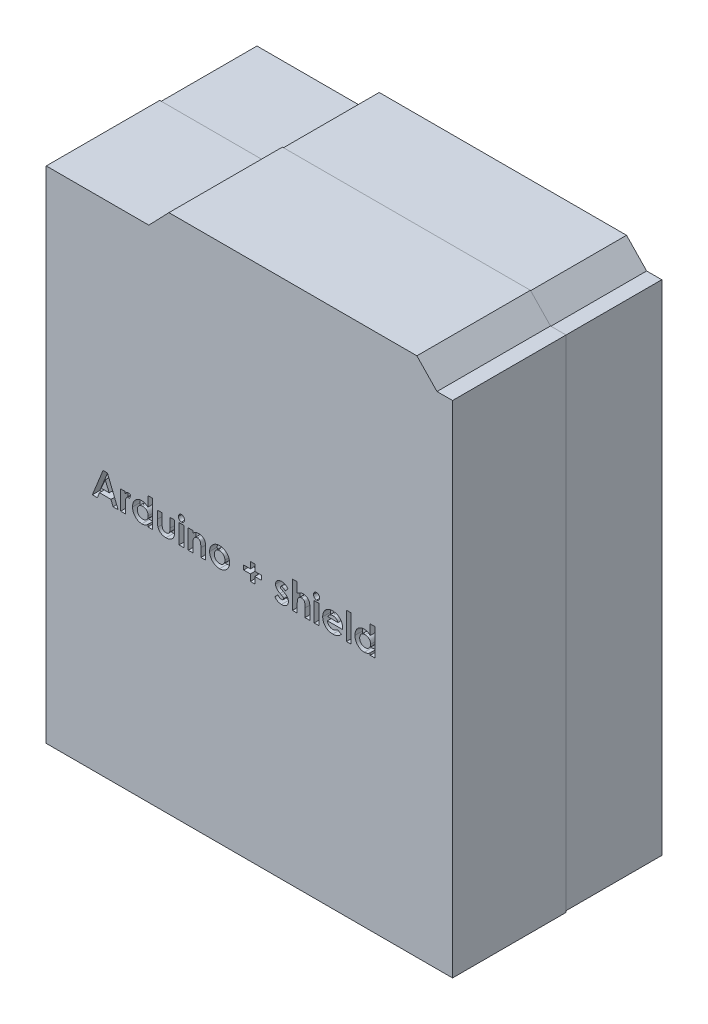
from build123d import *

# Parameters (mm, degrees)
SKETCH1_R           = 1.5
CARTE_DEPTH         = 12.75
PINS_DEPTH          = 2
BOSS_EXTRUDE3_DEPTH = 15
SKETCH4_W           = 0.628205128
SKETCH4_H           = 2.557692308
SKETCH4_W_2         = 0.628205129
SKETCH4_H_2         = 3.58974359
CUT_EXTRUDE1_DEPTH  = 1


with BuildPart() as part:
    # Sketch1 → carte (new body)
    with BuildSketch(Plane.XY):
        Polygon((-26.75, 32.95), (-13.25, 32.95), (-10.595, 35.71), (22.095, 35.71), (24.75, 32.95), (26.75, 32.95), (26.75, -32.95), (-26.75, -32.95), align=None)
        with Locations((19.45, 32.95)):
            Circle(SKETCH1_R, mode=Mode.SUBTRACT)
        with Locations((-8.75, 32.95)):
            Circle(SKETCH1_R, mode=Mode.SUBTRACT)
        with Locations((-24.05, -23.564882212)):
            Circle(SKETCH1_R, mode=Mode.SUBTRACT)
        with Locations((24.05, -23.564882212)):
            Circle(SKETCH1_R, mode=Mode.SUBTRACT)
    extrude(amount=CARTE_DEPTH)

    # Sketch2 → pins (add)
    with BuildSketch(Plane(origin=(0, 0, 0), x_dir=(-1, 0, 0), z_dir=(0, 0, -1))):
        Polygon((-21.75, 28.85639738), (-21.75, -27.95), (21.75, -27.95), (21.75, 27.95), (11.121914871, 27.95), (8.466914871, 30.71), (-19.966914871, 30.71), align=None)
        Polygon((-20.75, 28.453496065), (-20.75, -26.95), (20.75, -26.95), (20.75, 26.95), (10.696297845, 26.95), (8.041297845, 29.71), (-19.541297845, 29.71), align=None, mode=Mode.SUBTRACT)
    extrude(amount=PINS_DEPTH)

    # Sketch3 → Boss-Extrude3 (add)
    with BuildSketch(Plane.XY.offset(12.75)):
        Polygon((26.85, 33.05), (24.792561703, 33.05), (22.137561703, 35.81), (-10.637561703, 35.81), (-13.292561703, 33.05), (-26.85, 33.05), (-26.85, -33.05), (26.85, -33.05), align=None)
    extrude(amount=BOSS_EXTRUDE3_DEPTH)

    # Sketch4 → Cut-Extrude1 (cut)
    # profile 1 of 16: a face of its own
    with BuildSketch(Plane.XY.offset(27.75)):
        Polygon((-19.34439366, 1.94747819), (-18.761761448, 1.94747819), (-17.34829991, -1.55252181), (-18.019273468, -1.55252181), (-18.291308724, -0.834573092), (-19.816248628, -0.834573092), (-20.088283884, -1.55252181), (-20.75855632, -1.55252181), align=None)
        Polygon((-19.053428115, 1.008676107), (-19.577867218, -0.206367964), (-18.528989012, -0.206367964), align=None, mode=Mode.SUBTRACT)
    # profile 2 of 16: a face of its own
    with BuildSketch(Plane.XY.offset(27.75)):
        with BuildLine():
            Line((-17.011761448, 1.005170498), (-16.47329991, 1.005170498))
            Line((-16.47329991, 1.005170498), (-16.47329991, 0.690366812))
            add(Edge.make_bspline(
                [(-16.47329991, 0.690366812), (-16.458067867, 0.718343502), (-16.428296206, 0.773025104), (-16.373603169, 0.846424325), (-16.310769593, 0.908239102), (-16.242053282, 0.959762345), (-16.167245972, 0.999919655), (-16.088350867, 1.0285368), (-16.006042916, 1.047133979), (-15.949895221, 1.049065874), (-15.921517057, 1.050042293)],
                knots=[0, 0, 0, 0, 1.09866127, 2.147379032, 3.14564304, 4.131443017, 5.102343063, 6.064490016, 7.021754664, 8, 8, 8, 8], degree=3))
            add(Edge.make_bspline(
                [(-15.921517057, 1.050042293), (-15.900910969, 1.049077387), (-15.858949615, 1.047112496), (-15.794994608, 1.03569055), (-15.730116842, 1.015037499), (-15.687421681, 0.996442172), (-15.665607602, 0.986941331)],
                knots=[0, 0, 0, 0, 0.931404136, 1.896671404, 2.925354185, 4, 4, 4, 4], degree=3))
            Line((-15.665607602, 0.986941331), (-15.860519461, 0.454789889))
            add(Edge.make_bspline(
                [(-15.860519461, 0.454789889), (-15.877941798, 0.46320752), (-15.910689084, 0.479029425), (-15.958232458, 0.497700904), (-16.001380042, 0.509093327), (-16.028734817, 0.510793177), (-16.041408884, 0.511580754)],
                knots=[0, 0, 0, 0, 1.214386998, 2.282580073, 3.20428172, 4, 4, 4, 4], degree=3))
            add(Edge.make_bspline(
                [(-16.041408884, 0.511580754), (-16.053375668, 0.511058864), (-16.076916394, 0.510032215), (-16.111661846, 0.501234187), (-16.144384827, 0.48606226), (-16.176662255, 0.466625515), (-16.205947799, 0.439606986), (-16.235215254, 0.408328241), (-16.261007303, 0.369710471), (-16.288225394, 0.326726931), (-16.311400625, 0.274115117), (-16.331272672, 0.211307453), (-16.348978826, 0.137577211), (-16.361163077, 0.05253292), (-16.372939645, -0.043002469), (-16.379949347, -0.149730176), (-16.385173767, -0.267312716), (-16.385493205, -0.349389573), (-16.385659685, -0.392165239)],
                knots=[0, 0, 0, 0, 0.544232178, 1.070598461, 1.618251235, 2.182094276, 2.777567932, 3.425210017, 4.127676488, 4.886675562, 5.738955394, 6.734782583, 7.883056018, 9.186093582, 10.642914445, 12.264202625, 14.053029461, 16, 16, 16, 16], degree=3))
            Line((-16.385659685, -0.392165239), (-16.38355632, -0.516964919))
            Line((-16.38355632, -0.516964919), (-16.38355632, -1.55252181))
            Line((-16.38355632, -1.55252181), (-17.011761448, -1.55252181))
            Line((-17.011761448, -1.55252181), (-17.011761448, 1.005170498))
        make_face()
    # profile 3 of 16: a face of its own
    with BuildSketch(Plane.XY.offset(27.75)):
        with BuildLine():
            Line((-13.422017859, 2.03722178), (-12.79381273, 2.03722178))
            Line((-12.79381273, 2.03722178), (-12.79381273, -1.55252181))
            Line((-12.79381273, -1.55252181), (-13.422017859, -1.55252181))
            Line((-13.422017859, -1.55252181), (-13.422017859, -1.273475335))
            add(Edge.make_bspline(
                [(-13.422017859, -1.273475335), (-13.453145191, -1.300637421), (-13.513557197, -1.353353666), (-13.60874697, -1.421754334), (-13.704214898, -1.478176045), (-13.800419707, -1.52311286), (-13.898840026, -1.556294074), (-14.000184441, -1.580318047), (-14.105912419, -1.594485572), (-14.177784842, -1.596414163), (-14.214285487, -1.597393605)],
                knots=[0, 0, 0, 0, 1.129196829, 2.191548051, 3.199897424, 4.157751732, 5.089409408, 6.034969131, 7.002052659, 8, 8, 8, 8], degree=3))
            add(Edge.make_bspline(
                [(-14.214285487, -1.597393605), (-14.255259083, -1.596471827), (-14.336225231, -1.594650342), (-14.455034065, -1.575476272), (-14.569755805, -1.546126085), (-14.68029733, -1.504591902), (-14.78645752, -1.450771743), (-14.889048821, -1.386069852), (-14.986312507, -1.308214805), (-15.079058264, -1.220575191), (-15.163975723, -1.124170993), (-15.238211367, -1.020340286), (-15.300786498, -0.910555681), (-15.352050954, -0.795181165), (-15.392377069, -0.674301414), (-15.421123819, -0.547533036), (-15.438084434, -0.414830755), (-15.44018368, -0.324439158), (-15.441248628, -0.278583508)],
                knots=[0, 0, 0, 0, 0.980476535, 1.937477201, 2.874147792, 3.812856188, 4.758993464, 5.720109578, 6.712210464, 7.737600662, 8.772720504, 9.783789959, 10.789002326, 11.793715968, 12.802552247, 13.835794126, 14.902098527, 16, 16, 16, 16], degree=3))
            add(Edge.make_bspline(
                [(-15.441248628, -0.278583508), (-15.440130961, -0.231099923), (-15.437938534, -0.137955578), (-15.421901061, -0.001270681), (-15.393684797, 0.128640908), (-15.355209893, 0.251959137), (-15.30571861, 0.368705309), (-15.245441534, 0.479070692), (-15.173558652, 0.58276681), (-15.090726373, 0.67802868), (-15.001287856, 0.765340786), (-14.905604455, 0.841352898), (-14.805172448, 0.905928723), (-14.699885109, 0.958647657), (-14.589757473, 0.999386181), (-14.475224323, 1.029169369), (-14.355777211, 1.047040327), (-14.274408871, 1.049033327), (-14.233215775, 1.050042293)],
                knots=[0, 0, 0, 0, 1.136281865, 2.228943489, 3.287578264, 4.313574083, 5.316051562, 6.317280042, 7.318008486, 8.329309503, 9.333984563, 10.305318864, 11.248632312, 12.186624717, 13.117503092, 14.05354244, 15.014596925, 16, 16, 16, 16], degree=3))
            add(Edge.make_bspline(
                [(-14.233215775, 1.050042293), (-14.195082221, 1.048832436), (-14.119673116, 1.046439944), (-14.008280879, 1.031379805), (-13.901100392, 1.003022876), (-13.79682995, 0.966487057), (-13.696823706, 0.917322308), (-13.600544371, 0.858263674), (-13.507738265, 0.788561126), (-13.450952555, 0.734659082), (-13.422017859, 0.707193735)],
                knots=[0, 0, 0, 0, 1.011899165, 2.001030639, 2.974036179, 3.948778736, 4.92769327, 5.924124564, 6.942254589, 8, 8, 8, 8], degree=3))
            Line((-13.422017859, 0.707193735), (-13.422017859, 2.03722178))
        make_face()
        with BuildLine():
            add(Edge.make_bspline(
                [(-14.101404878, 0.466708959), (-14.126437, 0.465940888), (-14.175498326, 0.464435517), (-14.24764972, 0.455380606), (-14.316604807, 0.43942545), (-14.381871807, 0.415855134), (-14.444423436, 0.387143054), (-14.50330984, 0.351181647), (-14.559017024, 0.308676028), (-14.61121737, 0.260655257), (-14.658805676, 0.20787165), (-14.699829573, 0.150273299), (-14.734693258, 0.089412151), (-14.764178875, 0.025105219), (-14.785283886, -0.043408448), (-14.801999047, -0.115236924), (-14.810673133, -0.190967009), (-14.812245472, -0.242574719), (-14.8130435, -0.268767803)],
                knots=[0, 0, 0, 0, 1.04836806, 2.054732945, 3.03993516, 4.00574415, 4.955904794, 5.917688631, 6.888591924, 7.88601754, 8.884115178, 9.859153345, 10.841239365, 11.818093293, 12.814750328, 13.83810466, 14.90274714, 16, 16, 16, 16], degree=3))
            add(Edge.make_bspline(
                [(-14.8130435, -0.268767803), (-14.812257662, -0.295198474), (-14.810709178, -0.347279804), (-14.801858796, -0.423648701), (-14.785745115, -0.496526421), (-14.762235864, -0.5653238), (-14.733525614, -0.63096914), (-14.698578784, -0.693159483), (-14.655652724, -0.750795225), (-14.608022702, -0.805240222), (-14.554751474, -0.853857492), (-14.498729076, -0.897025163), (-14.439190286, -0.933143527), (-14.376781057, -0.962334616), (-14.311711462, -0.9861229), (-14.243165725, -1.001877532), (-14.171815338, -1.011949171), (-14.123173895, -1.013351712), (-14.098600391, -1.014060271)],
                knots=[0, 0, 0, 0, 1.099136573, 2.165835871, 3.191374663, 4.196217796, 5.183857741, 6.167377911, 7.154730987, 8.166690795, 9.170734848, 10.148332609, 11.103258353, 12.059567475, 13.009337315, 13.978056681, 14.978520572, 16, 16, 16, 16], degree=3))
            add(Edge.make_bspline(
                [(-14.098600391, -1.014060271), (-14.073102016, -1.013287893), (-14.023111339, -1.011773613), (-13.949782832, -1.002801338), (-13.87990143, -0.986787681), (-13.813757878, -0.963082419), (-13.750341895, -0.934576436), (-13.690225753, -0.899317742), (-13.634061804, -0.856909661), (-13.581565603, -0.808454781), (-13.533462955, -0.755240165), (-13.49187173, -0.696886502), (-13.455644251, -0.635260105), (-13.427153005, -0.568903899), (-13.404526961, -0.49897881), (-13.388293296, -0.425050866), (-13.379463124, -0.347040365), (-13.377928182, -0.293795158), (-13.377146064, -0.266664438)],
                knots=[0, 0, 0, 0, 1.050008698, 2.058587853, 3.036635738, 3.995319155, 4.947022481, 5.895997462, 6.858296291, 7.838991643, 8.833936038, 9.806048392, 10.784806122, 11.771666913, 12.772873988, 13.80724452, 14.882696879, 16, 16, 16, 16], degree=3))
            add(Edge.make_bspline(
                [(-13.377146064, -0.266664438), (-13.377918464, -0.240000353), (-13.379427185, -0.18791765), (-13.388331378, -0.111535971), (-13.404680293, -0.039059635), (-13.426840656, 0.02964458), (-13.455838769, 0.094419583), (-13.492093659, 0.154547173), (-13.533228653, 0.212110545), (-13.581863867, 0.263887541), (-13.634075684, 0.31199157), (-13.691065615, 0.353117199), (-13.751038167, 0.388560408), (-13.814361813, 0.417660648), (-13.881622901, 0.438992228), (-13.951623726, 0.45550849), (-14.025456444, 0.464430082), (-14.075675603, 0.465936937), (-14.101404878, 0.466708959)],
                knots=[0, 0, 0, 0, 1.106611376, 2.161533483, 3.185006901, 4.184773755, 5.152708835, 6.122342771, 7.094156588, 8.082475533, 9.064254463, 10.03606828, 10.992420271, 11.951521816, 12.920622147, 13.915721683, 14.932141191, 16, 16, 16, 16], degree=3))
        make_face(mode=Mode.SUBTRACT)
    # profile 4 of 16: a face of its own
    with BuildSketch(Plane.XY.offset(27.75)):
        with BuildLine():
            Line((-12.165607602, 1.005170498), (-11.537402474, 1.005170498))
            Line((-11.537402474, 1.005170498), (-11.537402474, -0.222493765))
            add(Edge.make_bspline(
                [(-11.537402474, -0.222493765), (-11.537346689, -0.251242699), (-11.537239624, -0.306418923), (-11.534260357, -0.385662784), (-11.530079855, -0.458127665), (-11.524862873, -0.523899018), (-11.517076192, -0.582818639), (-11.508086797, -0.634774049), (-11.497895723, -0.680139594), (-11.481323749, -0.730705542), (-11.455396598, -0.786040247), (-11.41624201, -0.844784534), (-11.368814384, -0.895581166), (-11.313754499, -0.938880936), (-11.250500058, -0.973002106), (-11.179922541, -0.996125502), (-11.102909959, -1.011666828), (-11.04927081, -1.013241431), (-11.021376833, -1.014060271)],
                knots=[0, 0, 0, 0, 1.267339619, 2.432334223, 3.495366327, 4.467371443, 5.340232306, 6.114347373, 6.791623365, 7.387877112, 8.457231658, 9.474542289, 10.487879852, 11.508108106, 12.54995813, 13.638205937, 14.771795776, 16, 16, 16, 16], degree=3))
            add(Edge.make_bspline(
                [(-11.021376833, -1.014060271), (-10.993507609, -1.013125681), (-10.939729741, -1.011322247), (-10.862204764, -0.99725859), (-10.79146101, -0.973160046), (-10.726771895, -0.940473214), (-10.670045106, -0.896727458), (-10.620655411, -0.844601287), (-10.579070447, -0.78325384), (-10.559086954, -0.737490402), (-10.548820743, -0.713980143)],
                knots=[0, 0, 0, 0, 1.116871431, 2.155171802, 3.144773418, 4.104381479, 5.046960687, 6.001340237, 6.973219418, 8, 8, 8, 8], degree=3))
            add(Edge.make_bspline(
                [(-10.548820743, -0.713980143), (-10.545053389, -0.703536675), (-10.536737388, -0.680483924), (-10.529335983, -0.640714756), (-10.521369867, -0.593813462), (-10.515068387, -0.538824232), (-10.511502787, -0.47608762), (-10.507682611, -0.405524557), (-10.505735781, -0.327205319), (-10.505483314, -0.27227416), (-10.505351192, -0.243527419)],
                knots=[0, 0, 0, 0, 0.56094539, 1.238222264, 2.041156151, 2.969685991, 4.036367568, 5.220421584, 6.545382566, 8, 8, 8, 8], degree=3))
            Line((-10.505351192, -0.243527419), (-10.505351192, 1.005170498))
            Line((-10.505351192, 1.005170498), (-9.877146064, 1.005170498))
            Line((-9.877146064, 1.005170498), (-9.877146064, -0.069649214))
            add(Edge.make_bspline(
                [(-9.877146064, -0.069649214), (-9.877254837, -0.122941054), (-9.877463388, -0.225117642), (-9.88344033, -0.371686638), (-9.891689189, -0.504947109), (-9.902312131, -0.625265964), (-9.917618478, -0.732693135), (-9.936407835, -0.826976704), (-9.957194863, -0.908739709), (-9.976257342, -0.957184855), (-9.98511882, -0.979705303)],
                knots=[0, 0, 0, 0, 1.388070971, 2.661352173, 3.82033814, 4.865898334, 5.806910977, 6.645039373, 7.370126333, 8, 8, 8, 8], degree=3))
            add(Edge.make_bspline(
                [(-9.98511882, -0.979705303), (-9.996476952, -1.003944264), (-10.01889693, -1.05178989), (-10.057799758, -1.119815775), (-10.099739186, -1.184264911), (-10.146710708, -1.243620229), (-10.197755489, -1.298484981), (-10.251430654, -1.350106377), (-10.310153453, -1.396382314), (-10.372400988, -1.438503603), (-10.439041835, -1.475894317), (-10.509619555, -1.509028823), (-10.584896851, -1.535994628), (-10.664220981, -1.558851952), (-10.747957575, -1.575897834), (-10.835937958, -1.588808789), (-10.928258622, -1.59548122), (-10.991219605, -1.596745698), (-11.023480198, -1.597393605)],
                knots=[0, 0, 0, 0, 0.997311338, 1.968606903, 2.91805772, 3.860812155, 4.785445165, 5.709667791, 6.633356648, 7.568312411, 8.508286151, 9.478643871, 10.470653671, 11.485274776, 12.552984541, 13.653035246, 14.797438149, 16, 16, 16, 16], degree=3))
            add(Edge.make_bspline(
                [(-11.023480198, -1.597393605), (-11.058330705, -1.596978279), (-11.126521328, -1.596165626), (-11.226146876, -1.58621382), (-11.321091362, -1.573337477), (-11.410294738, -1.551445334), (-11.49500277, -1.526082191), (-11.574242962, -1.493712074), (-11.648339109, -1.455653988), (-11.717437005, -1.412133562), (-11.781000752, -1.362751979), (-11.840443762, -1.309643805), (-11.893846958, -1.250696035), (-11.942953738, -1.187728999), (-11.987216042, -1.120163181), (-12.026655839, -1.048238823), (-12.061306537, -0.971628779), (-12.079794403, -0.917936077), (-12.089185327, -0.890662835)],
                knots=[0, 0, 0, 0, 1.211240017, 2.369985978, 3.478996442, 4.539426614, 5.559871561, 6.551301256, 7.510778031, 8.453136967, 9.386094087, 10.30661716, 11.221130616, 12.147659962, 13.080758632, 14.026335491, 14.997475882, 16, 16, 16, 16], degree=3))
            add(Edge.make_bspline(
                [(-12.089185327, -0.890662835), (-12.09559212, -0.869481392), (-12.109393848, -0.823851625), (-12.124295486, -0.748020279), (-12.136214357, -0.660620406), (-12.147808658, -0.561566037), (-12.155897055, -0.450691107), (-12.161183727, -0.3281717), (-12.164755768, -0.193768229), (-12.165315292, -0.100267339), (-12.165607602, -0.051420047)],
                knots=[0, 0, 0, 0, 0.627914866, 1.352675004, 2.190563461, 3.132055958, 4.183353232, 5.345633452, 6.613289997, 8, 8, 8, 8], degree=3))
            Line((-12.165607602, -0.051420047), (-12.165607602, 1.005170498))
        make_face()
    # profile 5 of 16: a face of its own
    with BuildSketch(Plane.XY.offset(27.75)):
        with BuildLine():
            add(Edge.make_bspline(
                [(-8.98111241, 2.082093575), (-8.954036773, 2.080765142), (-8.900871152, 2.078156635), (-8.824704165, 2.052729498), (-8.754798307, 2.012822367), (-8.692999591, 1.958068832), (-8.641601197, 1.892683096), (-8.602330915, 1.819479418), (-8.580455077, 1.7383721), (-8.577416846, 1.682344013), (-8.575864012, 1.653708158)],
                knots=[0, 0, 0, 0, 0.989868614, 1.943702388, 2.910836514, 3.924849579, 4.949916355, 5.946401046, 6.950409252, 8, 8, 8, 8], degree=3))
            add(Edge.make_bspline(
                [(-8.575864012, 1.653708158), (-8.577361289, 1.625283334), (-8.580278803, 1.56989621), (-8.602834401, 1.489889961), (-8.64052851, 1.416721838), (-8.692343199, 1.352307202), (-8.753471937, 1.298435505), (-8.821850298, 1.257803884), (-8.897287384, 1.233791253), (-8.949628035, 1.23096469), (-8.976204557, 1.229529472)],
                knots=[0, 0, 0, 0, 1.05296456, 2.051751585, 3.055639087, 4.085634717, 5.099016424, 6.062201612, 7.016062274, 8, 8, 8, 8], degree=3))
            add(Edge.make_bspline(
                [(-8.976204557, 1.229529472), (-9.003516542, 1.230853157), (-9.057144702, 1.233452263), (-9.133936415, 1.258938893), (-9.204774638, 1.29853173), (-9.266305272, 1.354403965), (-9.318292293, 1.420254316), (-9.355847233, 1.495162239), (-9.379338777, 1.576824167), (-9.382127203, 1.633682068), (-9.38355632, 1.662822742)],
                knots=[0, 0, 0, 0, 0.989065327, 1.942068821, 2.907541208, 3.917690034, 4.939857478, 5.938239964, 6.943311734, 8, 8, 8, 8], degree=3))
            add(Edge.make_bspline(
                [(-9.38355632, 1.662822742), (-9.38200105, 1.690764895), (-9.378945946, 1.745653223), (-9.356939069, 1.824957288), (-9.318569254, 1.896930298), (-9.267541087, 1.961119086), (-9.206285171, 2.014851262), (-9.136421279, 2.053546388), (-9.060766899, 2.077923311), (-9.007938063, 2.080689134), (-8.98111241, 2.082093575)],
                knots=[0, 0, 0, 0, 1.038616768, 2.040212704, 3.031499824, 4.052181184, 5.074969369, 6.039807101, 7.004644834, 8, 8, 8, 8], degree=3))
        make_face()
    # profile 6 of 16: a face of its own
    with BuildSketch(Plane.XY.offset(27.75)):
        with Locations((-8.979710166, -0.273675656)):
            Rectangle(SKETCH4_W, SKETCH4_H)
    # profile 7 of 16: a face of its own
    with BuildSketch(Plane.XY.offset(27.75)):
        with BuildLine():
            Line((-8.082274269, 1.005170498), (-7.454069141, 1.005170498))
            Line((-7.454069141, 1.005170498), (-7.454069141, 0.734537485))
            add(Edge.make_bspline(
                [(-7.454069141, 0.734537485), (-7.418230349, 0.762413635), (-7.349735453, 0.815690376), (-7.245611383, 0.883618493), (-7.147331154, 0.939214929), (-7.052703992, 0.981504423), (-6.959949485, 1.011929896), (-6.867565408, 1.033788783), (-6.774175974, 1.047785629), (-6.711395606, 1.049290475), (-6.680030679, 1.050042293)],
                knots=[0, 0, 0, 0, 1.276643801, 2.439914479, 3.493451431, 4.44993799, 5.350072675, 6.235028322, 7.118224225, 8, 8, 8, 8], degree=3))
            add(Edge.make_bspline(
                [(-6.680030679, 1.050042293), (-6.648215181, 1.049183121), (-6.585758687, 1.047496495), (-6.493794941, 1.035699909), (-6.405932513, 1.01421459), (-6.321183462, 0.985687897), (-6.240410389, 0.948034299), (-6.162623773, 0.90332676), (-6.089494445, 0.848869953), (-6.044458167, 0.807398264), (-6.021677314, 0.786420498)],
                knots=[0, 0, 0, 0, 1.048836932, 2.058954983, 3.049370783, 4.026390553, 5.001981509, 5.982488534, 6.97947532, 8, 8, 8, 8], degree=3))
            add(Edge.make_bspline(
                [(-6.021677314, 0.786420498), (-6.003406231, 0.766980243), (-5.966730342, 0.727957455), (-5.920578344, 0.661179469), (-5.880974739, 0.588379242), (-5.848525087, 0.508716999), (-5.824546102, 0.421755048), (-5.806098741, 0.328543764), (-5.795747605, 0.228561234), (-5.794469709, 0.15987418), (-5.79381273, 0.124561524)],
                knots=[0, 0, 0, 0, 0.889584746, 1.785680191, 2.700364693, 3.65222533, 4.649950538, 5.707241244, 6.821271309, 8, 8, 8, 8], degree=3))
            Line((-5.79381273, 0.124561524), (-5.79381273, -1.55252181))
            Line((-5.79381273, -1.55252181), (-6.422017859, -1.55252181))
            Line((-6.422017859, -1.55252181), (-6.422017859, -0.441944887))
            add(Edge.make_bspline(
                [(-6.422017859, -0.441944887), (-6.42215071, -0.405719802), (-6.422405295, -0.336301151), (-6.424359947, -0.236952629), (-6.428176565, -0.147228012), (-6.431655314, -0.066963938), (-6.438485479, 0.003554603), (-6.444645033, 0.064774047), (-6.454096272, 0.116139005), (-6.466393866, 0.171389725), (-6.487868495, 0.230545725), (-6.521206809, 0.292876343), (-6.563501135, 0.345827593), (-6.613024004, 0.389770689), (-6.669720723, 0.424533708), (-6.732906193, 0.448991658), (-6.802241666, 0.464234452), (-6.850553808, 0.465863137), (-6.87564366, 0.466708959)],
                knots=[0, 0, 0, 0, 1.49886392, 2.872294502, 4.110984203, 5.214877267, 6.195405875, 7.042225351, 7.75923308, 8.355011229, 9.382752534, 10.352059385, 11.267231453, 12.171456522, 13.078624015, 14.003401117, 14.963110155, 16, 16, 16, 16], degree=3))
            add(Edge.make_bspline(
                [(-6.87564366, 0.466708959), (-6.908274067, 0.465054263), (-6.972105488, 0.461817354), (-7.064424868, 0.437408112), (-7.14921868, 0.395895175), (-7.22579409, 0.338449619), (-7.29342178, 0.267525961), (-7.34912174, 0.182941363), (-7.394807149, 0.086737269), (-7.414452554, 0.016492654), (-7.424622025, -0.019869566)],
                knots=[0, 0, 0, 0, 0.984188326, 1.925263693, 2.85911992, 3.81709677, 4.80007086, 5.801799564, 6.862098548, 8, 8, 8, 8], degree=3))
            add(Edge.make_bspline(
                [(-7.424622025, -0.019869566), (-7.427149543, -0.031289365), (-7.432786415, -0.056757813), (-7.437422029, -0.099783972), (-7.443870505, -0.150830344), (-7.446286591, -0.210820724), (-7.450487897, -0.279471203), (-7.452041741, -0.356872604), (-7.453598366, -0.442873156), (-7.453907017, -0.502941274), (-7.454069141, -0.534492964)],
                knots=[0, 0, 0, 0, 0.543362196, 1.211806945, 2.009705693, 2.934833164, 4.000995085, 5.207458376, 6.533175157, 8, 8, 8, 8], degree=3))
            Line((-7.454069141, -0.534492964), (-7.454069141, -1.55252181))
            Line((-7.454069141, -1.55252181), (-8.082274269, -1.55252181))
            Line((-8.082274269, -1.55252181), (-8.082274269, 1.005170498))
        make_face()
    # profile 8 of 16: a face of its own
    with BuildSketch(Plane.XY.offset(27.75)):
        with BuildLine():
            add(Edge.make_bspline(
                [(-3.947057923, 1.050042293), (-3.917357597, 1.049513755), (-3.858537494, 1.048467011), (-3.770932299, 1.039753823), (-3.684858645, 1.025537898), (-3.599821792, 1.007130757), (-3.516611386, 0.981339599), (-3.434790999, 0.950407092), (-3.353629054, 0.914892957), (-3.275139972, 0.872618715), (-3.19875673, 0.826768444), (-3.12634087, 0.776191832), (-3.058493757, 0.721286143), (-2.993955917, 0.663324408), (-2.935734917, 0.599783161), (-2.880110124, 0.533724087), (-2.83008681, 0.46278052), (-2.783772427, 0.38868119), (-2.742539065, 0.311854598), (-2.706735473, 0.23283518), (-2.675661321, 0.152715432), (-2.651330883, 0.070519443), (-2.631187523, -0.012668924), (-2.618475631, -0.097869081), (-2.609438358, -0.184205809), (-2.608424993, -0.242334798), (-2.607915294, -0.271572291)],
                knots=[0, 0, 0, 0, 1.022364134, 2.024744242, 3.027414945, 4.024939316, 5.017584196, 6.023349371, 7.035562955, 8.064994934, 9.090267829, 10.101425541, 11.102933353, 12.093946398, 13.084502048, 14.067315274, 15.065326281, 16.070028806, 17.074376865, 18.064572984, 19.055292013, 20.030201733, 21.013838017, 21.999348303, 22.993720005, 24, 24, 24, 24], degree=3))
            add(Edge.make_bspline(
                [(-2.607915294, -0.271572291), (-2.608453197, -0.301038201), (-2.609522668, -0.359623111), (-2.618148674, -0.446771942), (-2.632419013, -0.532372755), (-2.650896802, -0.616929841), (-2.676591442, -0.69936121), (-2.706612887, -0.780881933), (-2.743465392, -0.860380853), (-2.784208551, -0.938725226), (-2.830820716, -1.013609619), (-2.88080073, -1.08526387), (-2.936192539, -1.151808151), (-2.993947463, -1.215306187), (-3.056804949, -1.273610756), (-3.123761674, -1.327668572), (-3.194237979, -1.378140513), (-3.268740662, -1.423842414), (-3.34631547, -1.463999045), (-3.425654116, -1.500203525), (-3.50722053, -1.530346339), (-3.590845906, -1.554926974), (-3.676580959, -1.573959145), (-3.764236408, -1.586887924), (-3.853623477, -1.595879742), (-3.913848964, -1.596885735), (-3.944253435, -1.597393605)],
                knots=[0, 0, 0, 0, 1.012026251, 2.012137606, 3.004615893, 3.992048833, 4.982446996, 5.968083444, 6.973977695, 7.990229942, 8.999482246, 10.001782172, 10.988562221, 11.971415814, 12.948383116, 13.930088534, 14.925840678, 15.924049238, 16.929462851, 17.924729459, 18.917889337, 19.913673841, 20.916777188, 21.931792057, 22.95587778, 24, 24, 24, 24], degree=3))
            add(Edge.make_bspline(
                [(-3.944253435, -1.597393605), (-3.988710973, -1.596088688), (-4.076337455, -1.593516678), (-4.205390547, -1.575899082), (-4.329367967, -1.545574581), (-4.448471734, -1.503302894), (-4.562856569, -1.449133303), (-4.671524211, -1.382090208), (-4.775555607, -1.303493495), (-4.873148855, -1.214007471), (-4.962557491, -1.1158332), (-5.040666692, -1.011032763), (-5.106987724, -0.901176944), (-5.16146092, -0.786140469), (-5.203503118, -0.665765593), (-5.233864759, -0.540412194), (-5.251503894, -0.409727922), (-5.254054151, -0.320937258), (-5.255351192, -0.275779021)],
                knots=[0, 0, 0, 0, 1.029999031, 2.030143771, 3.011211297, 3.982305373, 4.953580601, 5.938004764, 6.935448627, 7.970290061, 9.001484052, 10.007591832, 10.993831261, 11.969999897, 12.951306496, 13.942897864, 14.953773953, 16, 16, 16, 16], degree=3))
            add(Edge.make_bspline(
                [(-5.255351192, -0.275779021), (-5.254008919, -0.227559924), (-5.25137071, -0.132786253), (-5.230422165, 0.006059335), (-5.196969599, 0.138997405), (-5.148950547, 0.265656088), (-5.087610432, 0.386268988), (-5.012728053, 0.500581719), (-4.923933336, 0.608620175), (-4.855934364, 0.673965536), (-4.821356801, 0.707193735)],
                knots=[0, 0, 0, 0, 1.043912699, 2.05178951, 3.033892, 4.007821512, 4.978932272, 5.95884105, 6.962068106, 8, 8, 8, 8], degree=3))
            add(Edge.make_bspline(
                [(-4.821356801, 0.707193735), (-4.789628431, 0.734736174), (-4.727034924, 0.789071705), (-4.625341077, 0.857987418), (-4.521218053, 0.917509569), (-4.413417893, 0.966447847), (-4.301640077, 1.00334652), (-4.186457404, 1.030205452), (-4.067893823, 1.046702995), (-3.987541247, 1.048923537), (-3.947057923, 1.050042293)],
                knots=[0, 0, 0, 0, 1.048115528, 2.067714963, 3.060638214, 4.039924844, 5.017819947, 5.994373833, 6.98952318, 8, 8, 8, 8], degree=3))
        make_face()
        with BuildLine():
            add(Edge.make_bspline(
                [(-3.933035487, 0.466708959), (-3.957357865, 0.465900564), (-4.00523673, 0.464309229), (-4.075715676, 0.45576896), (-4.142375405, 0.438264945), (-4.206539904, 0.416004628), (-4.267074097, 0.386234591), (-4.325635799, 0.351396787), (-4.37917993, 0.307801563), (-4.430297664, 0.25998079), (-4.476701171, 0.206877106), (-4.516241366, 0.149020682), (-4.551571407, 0.088624984), (-4.578360384, 0.023478849), (-4.600530824, -0.044637089), (-4.615535512, -0.116823377), (-4.625977728, -0.192273655), (-4.626752914, -0.243957612), (-4.627146064, -0.270170047)],
                knots=[0, 0, 0, 0, 1.030650113, 2.02884584, 2.99876339, 3.944280128, 4.900564847, 5.851248946, 6.823638398, 7.81794922, 8.81432732, 9.802856497, 10.78262424, 11.771747962, 12.779760563, 13.812642396, 14.89064281, 16, 16, 16, 16], degree=3))
            add(Edge.make_bspline(
                [(-4.627146064, -0.270170047), (-4.626686025, -0.297306865), (-4.625786968, -0.350340563), (-4.616477046, -0.427776895), (-4.601124678, -0.501263461), (-4.579313774, -0.570686739), (-4.55188288, -0.636545042), (-4.518228353, -0.698468861), (-4.477995009, -0.75608587), (-4.432380161, -0.809325119), (-4.382433852, -0.857650975), (-4.32770659, -0.899122417), (-4.270490149, -0.935155595), (-4.20946595, -0.964095799), (-4.145500712, -0.986439984), (-4.078404549, -1.002891256), (-4.00782487, -1.011754404), (-3.959700683, -1.01328108), (-3.935138852, -1.014060271)],
                knots=[0, 0, 0, 0, 1.141730614, 2.231293227, 3.276944405, 4.297399982, 5.28939179, 6.275415646, 7.257752684, 8.24146775, 9.222424823, 10.176631434, 11.126518621, 12.063689483, 13.012557477, 13.974037417, 14.965980454, 16, 16, 16, 16], degree=3))
            add(Edge.make_bspline(
                [(-3.935138852, -1.014060271), (-3.910564737, -1.013369164), (-3.862385205, -1.012014191), (-3.791722644, -1.001867588), (-3.724283838, -0.985898836), (-3.659772287, -0.963362342), (-3.598709572, -0.933802688), (-3.540861941, -0.897597123), (-3.485720499, -0.855548851), (-3.435103905, -0.806311178), (-3.388249092, -0.752905895), (-3.347160223, -0.694984729), (-3.312824815, -0.633060895), (-3.284663632, -0.567524017), (-3.262809971, -0.498464177), (-3.247711764, -0.425624686), (-3.237263966, -0.34923128), (-3.236506312, -0.296849261), (-3.236120423, -0.270170047)],
                knots=[0, 0, 0, 0, 1.031504075, 2.022346795, 2.991027682, 3.937587355, 4.885570121, 5.833146507, 6.798790848, 7.791235734, 8.792807298, 9.778388351, 10.766749885, 11.760164525, 12.768777521, 13.802286646, 14.880660483, 16, 16, 16, 16], degree=3))
            add(Edge.make_bspline(
                [(-3.236120423, -0.270170047), (-3.236586313, -0.243500158), (-3.237500542, -0.191165183), (-3.246811128, -0.114668457), (-3.262012832, -0.042064403), (-3.284105049, 0.026336963), (-3.311372898, 0.091315993), (-3.345050686, 0.152540085), (-3.385482449, 0.209707693), (-3.431319042, 0.262535349), (-3.482014079, 0.310183083), (-3.535791143, 0.352673295), (-3.593879951, 0.387815965), (-3.655190723, 0.41678607), (-3.719886577, 0.43907443), (-3.787894881, 0.455618936), (-3.859424059, 0.464355965), (-3.908241902, 0.465916431), (-3.933035487, 0.466708959)],
                knots=[0, 0, 0, 0, 1.123894411, 2.205445421, 3.243160173, 4.246488011, 5.231014757, 6.210004299, 7.185865357, 8.177612767, 9.153374344, 10.115157457, 11.061423229, 12.009021698, 12.96873347, 13.94135618, 14.954456845, 16, 16, 16, 16], degree=3))
        make_face(mode=Mode.SUBTRACT)
    # profile 9 of 16: a face of its own
    with BuildSketch(Plane.XY.offset(27.75)):
        Polygon((0.129264193, 0.421837165), (0.129264193, 1.274401267), (0.712597526, 1.274401267), (0.712597526, 0.421837165), (1.610033423, 0.421837165), (1.610033423, -0.161496169), (0.712597526, -0.161496169), (0.712597526, -1.014060271), (0.129264193, -1.014060271), (0.129264193, -0.161496169), (-0.768171705, -0.161496169), (-0.768171705, 0.421837165), align=None)
    # profile 10 of 16: a face of its own
    with BuildSketch(Plane.XY.offset(27.75)):
        with BuildLine():
            Line((5.110033423, 0.610438927), (4.72581868, 0.19747819))
            add(Edge.make_bspline(
                [(4.72581868, 0.19747819), (4.706632997, 0.218708188), (4.669938054, 0.259313133), (4.613761642, 0.314666747), (4.558421806, 0.360759957), (4.5049498, 0.399480173), (4.452253535, 0.429173951), (4.400771035, 0.450537959), (4.350477598, 0.464100149), (4.317140982, 0.465855723), (4.300938872, 0.466708959)],
                knots=[0, 0, 0, 0, 1.327646587, 2.539285, 3.655602211, 4.666613517, 5.598770349, 6.454635452, 7.248928967, 8, 8, 8, 8], degree=3))
            add(Edge.make_bspline(
                [(4.300938872, 0.466708959), (4.284543964, 0.466209299), (4.253152816, 0.465252604), (4.208852871, 0.457046563), (4.169932406, 0.442840394), (4.136998799, 0.423476062), (4.110539357, 0.399621194), (4.092013867, 0.372331787), (4.07957383, 0.342456606), (4.078521484, 0.321235112), (4.077982141, 0.310358799)],
                knots=[0, 0, 0, 0, 1.295068245, 2.479652818, 3.543291146, 4.55379989, 5.481948265, 6.332409746, 7.145336708, 8, 8, 8, 8], degree=3))
            add(Edge.make_bspline(
                [(4.077982141, 0.310358799), (4.079809483, 0.293876485), (4.083601003, 0.259677598), (4.109643492, 0.220011991), (4.144099586, 0.190751485), (4.183817498, 0.163522904), (4.237605835, 0.133078434), (4.278411032, 0.112232217), (4.300938872, 0.100723383)],
                knots=[0, 0, 0, 0, 0.916701701, 1.902049539, 2.5493345, 3.440293453, 4.586830489, 6, 6, 6, 6], degree=3))
            Line((4.300938872, 0.100723383), (4.528102334, -0.014260592))
            add(Edge.make_bspline(
                [(4.528102334, -0.014260592), (4.557001869, -0.028934837), (4.613072397, -0.05740563), (4.691902307, -0.103347077), (4.764710868, -0.147876827), (4.830037563, -0.193513806), (4.888282232, -0.239465147), (4.939031166, -0.286185248), (4.983515284, -0.332192994), (5.033121319, -0.393876804), (5.082742242, -0.476034619), (5.124110681, -0.582877029), (5.150490831, -0.697281758), (5.153409491, -0.776465634), (5.154905218, -0.817045047)],
                knots=[0, 0, 0, 0, 1.076693506, 2.088987655, 3.030641824, 3.911722491, 4.735175175, 5.493635918, 6.202154166, 6.859459289, 8.120623445, 9.372284821, 10.653373066, 12, 12, 12, 12], degree=3))
            add(Edge.make_bspline(
                [(5.154905218, -0.817045047), (5.154004033, -0.844421644), (5.152240174, -0.898004911), (5.141089429, -0.976874371), (5.121059805, -1.05186755), (5.094700849, -1.124153442), (5.059196125, -1.192424898), (5.016091651, -1.257012874), (4.966068062, -1.318765375), (4.907802913, -1.375569969), (4.843974416, -1.428511229), (4.77301827, -1.473038631), (4.698071848, -1.51218845), (4.617155183, -1.542760974), (4.531403638, -1.567547168), (4.440082143, -1.584723379), (4.343500572, -1.595532809), (4.277364431, -1.596762807), (4.243446885, -1.597393605)],
                knots=[0, 0, 0, 0, 0.976600749, 1.911466839, 2.833459288, 3.740827163, 4.650527853, 5.570709661, 6.506801416, 7.479409329, 8.468875524, 9.458587492, 10.461481786, 11.480119772, 12.538142914, 13.641687514, 14.790552763, 16, 16, 16, 16], degree=3))
            add(Edge.make_bspline(
                [(4.243446885, -1.597393605), (4.198509049, -1.595962584), (4.110300034, -1.593153617), (3.981477152, -1.573586754), (3.859834153, -1.539716184), (3.745270956, -1.492267848), (3.637085878, -1.431805661), (3.536823924, -1.356785322), (3.442746961, -1.269161428), (3.388012006, -1.201957982), (3.360033423, -1.167605944)],
                knots=[0, 0, 0, 0, 1.056901255, 2.07460411, 3.05625841, 4.019970729, 4.984811261, 5.963335951, 6.958928997, 8, 8, 8, 8], degree=3))
            Line((3.360033423, -1.167605944), (3.740742558, -0.744829502))
            add(Edge.make_bspline(
                [(3.740742558, -0.744829502), (3.759291993, -0.764394386), (3.796118687, -0.803237078), (3.858193613, -0.85445642), (3.92387328, -0.901139081), (3.993888861, -0.940337286), (4.06391859, -0.971988072), (4.131106336, -0.995730589), (4.194185874, -1.010651158), (4.235198563, -1.012962985), (4.254664834, -1.014060271)],
                knots=[0, 0, 0, 0, 1.087861918, 2.159761696, 3.243809206, 4.338405912, 5.394481878, 6.343674753, 7.213841449, 8, 8, 8, 8], degree=3))
            add(Edge.make_bspline(
                [(4.254664834, -1.014060271), (4.274120568, -1.01349682), (4.311519859, -1.012413712), (4.364673935, -1.001147258), (4.411786842, -0.982206684), (4.451740341, -0.955945098), (4.484972592, -0.925800808), (4.508388343, -0.891541645), (4.523872076, -0.855213894), (4.525753943, -0.829814912), (4.52670009, -0.817045047)],
                knots=[0, 0, 0, 0, 1.255011871, 2.412479185, 3.488767498, 4.514443302, 5.48617286, 6.365347346, 7.178144445, 8, 8, 8, 8], degree=3))
            add(Edge.make_bspline(
                [(4.52670009, -0.817045047), (4.525855846, -0.80501953), (4.52412245, -0.780328827), (4.510399099, -0.743883582), (4.488853168, -0.707796942), (4.458970137, -0.671967162), (4.420352375, -0.636684958), (4.373138084, -0.602232929), (4.3184165, -0.566773017), (4.277996023, -0.545608198), (4.256768199, -0.534492964)],
                knots=[0, 0, 0, 0, 0.704666567, 1.446816302, 2.258757648, 3.165368109, 4.175243826, 5.322435858, 6.59381024, 8, 8, 8, 8], degree=3))
            Line((4.256768199, -0.534492964), (4.048535026, -0.429324694))
            add(Edge.make_bspline(
                [(4.048535026, -0.429324694), (4.00129943, -0.403995078), (3.910624795, -0.355371711), (3.788066585, -0.271992971), (3.684338754, -0.183234643), (3.599356771, -0.089573566), (3.531642959, 0.008727423), (3.484408032, 0.112919889), (3.454692948, 0.222016063), (3.451423814, 0.29661721), (3.449777013, 0.33419694)],
                knots=[0, 0, 0, 0, 1.255999728, 2.41104856, 3.467751088, 4.449286722, 5.368722015, 6.253902015, 7.120417131, 8, 8, 8, 8], degree=3))
            add(Edge.make_bspline(
                [(3.449777013, 0.33419694), (3.45034811, 0.358552589), (3.451469265, 0.406366685), (3.463404639, 0.476584999), (3.481436428, 0.54408265), (3.506881225, 0.608966829), (3.539475565, 0.671301919), (3.579409287, 0.730811283), (3.627169578, 0.787386731), (3.681227429, 0.840846021), (3.741206312, 0.889533699), (3.805392539, 0.932682367), (3.873596257, 0.969437008), (3.946377207, 0.998740423), (4.022810303, 1.022064117), (4.103400084, 1.037917901), (4.187802718, 1.048000963), (4.245520659, 1.049352208), (4.274997366, 1.050042293)],
                knots=[0, 0, 0, 0, 0.959035663, 1.882742823, 2.798841253, 3.708806893, 4.623422363, 5.566085165, 6.527241613, 7.536786942, 8.55815439, 9.567237405, 10.580975912, 11.605536372, 12.654523293, 13.725718749, 14.838518481, 16, 16, 16, 16], degree=3))
            add(Edge.make_bspline(
                [(4.274997366, 1.050042293), (4.315749103, 1.048700578), (4.396634114, 1.046037509), (4.515923596, 1.024487945), (4.631144863, 0.988268102), (4.741974895, 0.938363216), (4.846988071, 0.875646956), (4.943875101, 0.799488235), (5.033291684, 0.711762426), (5.084198823, 0.644548815), (5.110033423, 0.610438927)],
                knots=[0, 0, 0, 0, 0.996590028, 1.978055413, 2.954661574, 3.945146934, 4.945404762, 5.939399542, 6.954276554, 8, 8, 8, 8], degree=3))
        make_face()
    # profile 11 of 16: a face of its own
    with BuildSketch(Plane.XY.offset(27.75)):
        with BuildLine():
            Line((5.693366757, 2.03722178), (6.321571885, 2.03722178))
            Line((6.321571885, 2.03722178), (6.321571885, 0.728227389))
            add(Edge.make_bspline(
                [(6.321571885, 0.728227389), (6.353215909, 0.753962178), (6.414895594, 0.804123742), (6.511673044, 0.869472357), (6.60825032, 0.925237206), (6.705652252, 0.970430802), (6.803456274, 1.005846378), (6.901831277, 1.030962513), (7.000871966, 1.047440914), (7.067267363, 1.049174242), (7.100518199, 1.050042293)],
                knots=[0, 0, 0, 0, 1.13710654, 2.216417683, 3.252896077, 4.244436563, 5.207303112, 6.149540546, 7.073289332, 8, 8, 8, 8], degree=3))
            add(Edge.make_bspline(
                [(7.100518199, 1.050042293), (7.132337017, 1.049198007), (7.194800029, 1.047540602), (7.286437054, 1.035568934), (7.374207025, 1.014968781), (7.458326157, 0.986650298), (7.538215728, 0.94856611), (7.614914613, 0.903955293), (7.687511142, 0.850507362), (7.731681995, 0.809307089), (7.753963712, 0.788523863)],
                knots=[0, 0, 0, 0, 1.056403236, 2.073808271, 3.062028718, 4.046096703, 5.014652014, 5.995532726, 6.988858718, 8, 8, 8, 8], degree=3))
            add(Edge.make_bspline(
                [(7.753963712, 0.788523863), (7.772262884, 0.769103842), (7.80912673, 0.729982034), (7.855039666, 0.662536941), (7.894685029, 0.589072499), (7.926990347, 0.508898367), (7.951016309, 0.421977226), (7.969617275, 0.329025143), (7.979904005, 0.229027189), (7.98117353, 0.160107357), (7.981828295, 0.124561524)],
                knots=[0, 0, 0, 0, 0.887296576, 1.787466942, 2.706642908, 3.663267187, 4.658426068, 5.705361056, 6.816525637, 8, 8, 8, 8], degree=3))
            Line((7.981828295, 0.124561524), (7.981828295, -1.55252181))
            Line((7.981828295, -1.55252181), (7.353623167, -1.55252181))
            Line((7.353623167, -1.55252181), (7.353623167, -0.440542643))
            add(Edge.make_bspline(
                [(7.353623167, -0.440542643), (7.353501105, -0.405251781), (7.353267467, -0.337701431), (7.351169389, -0.240697355), (7.347743161, -0.15257286), (7.343057638, -0.073301315), (7.336515625, -0.00321401), (7.330081095, 0.058191417), (7.321051941, 0.110620625), (7.307531928, 0.167589942), (7.285529303, 0.228523224), (7.253555908, 0.293475484), (7.210848236, 0.347081062), (7.161424668, 0.391292223), (7.104279471, 0.425035855), (7.041458386, 0.449958315), (6.971887453, 0.463974091), (6.923664013, 0.465773526), (6.898595122, 0.466708959)],
                knots=[0, 0, 0, 0, 1.461461505, 2.797388094, 4.017818807, 5.113567707, 6.085313608, 6.932873269, 7.669572396, 8.286941306, 9.355291607, 10.346554054, 11.270113241, 12.175128673, 13.078071705, 14.003657132, 14.962203834, 16, 16, 16, 16], degree=3))
            add(Edge.make_bspline(
                [(6.898595122, 0.466708959), (6.865937785, 0.465432277), (6.801974707, 0.462931749), (6.710248825, 0.437191811), (6.625643765, 0.39650657), (6.549146949, 0.340118657), (6.482488091, 0.269490551), (6.426638255, 0.186707357), (6.380956147, 0.092597086), (6.361211518, 0.02397025), (6.351019, -0.011456105)],
                knots=[0, 0, 0, 0, 0.993549393, 1.945978497, 2.879753144, 3.843180486, 4.826017097, 5.826060929, 6.877775219, 8, 8, 8, 8], degree=3))
            add(Edge.make_bspline(
                [(6.351019, -0.011456105), (6.348481042, -0.022405876), (6.342693666, -0.047374936), (6.338261583, -0.089976442), (6.331684444, -0.141474363), (6.32940294, -0.202177301), (6.325129141, -0.27199163), (6.323592116, -0.351030304), (6.322044721, -0.43936763), (6.321734564, -0.501305318), (6.321571885, -0.533791842)],
                knots=[0, 0, 0, 0, 0.514379255, 1.17295301, 1.959069106, 2.891908278, 3.953016936, 5.163065833, 6.51201855, 8, 8, 8, 8], degree=3))
            Line((6.321571885, -0.533791842), (6.321571885, -1.55252181))
            Line((6.321571885, -1.55252181), (5.693366757, -1.55252181))
            Line((5.693366757, -1.55252181), (5.693366757, 2.03722178))
        make_face()
    # profile 12 of 16: a face of its own
    with BuildSketch(Plane.XY.offset(27.75)):
        with BuildLine():
            add(Edge.make_bspline(
                [(8.877861949, 2.082093575), (8.904937586, 2.080765142), (8.958103207, 2.078156635), (9.034270194, 2.052729498), (9.104176052, 2.012822367), (9.165974768, 1.958068832), (9.217373162, 1.892683096), (9.256643444, 1.819479418), (9.278519282, 1.7383721), (9.281557513, 1.682344013), (9.283110347, 1.653708158)],
                knots=[0, 0, 0, 0, 0.989868614, 1.943702388, 2.910836514, 3.924849579, 4.949916355, 5.946401046, 6.950409252, 8, 8, 8, 8], degree=3))
            add(Edge.make_bspline(
                [(9.283110347, 1.653708158), (9.28161307, 1.625283334), (9.278695556, 1.56989621), (9.256139958, 1.489889961), (9.218445849, 1.416721838), (9.16663116, 1.352307202), (9.105502422, 1.298435505), (9.037124061, 1.257803884), (8.961686975, 1.233791253), (8.909346324, 1.23096469), (8.882769802, 1.229529472)],
                knots=[0, 0, 0, 0, 1.05296456, 2.051751585, 3.055639087, 4.085634717, 5.099016424, 6.062201612, 7.016062274, 8, 8, 8, 8], degree=3))
            add(Edge.make_bspline(
                [(8.882769802, 1.229529472), (8.855457817, 1.230853157), (8.801829657, 1.233452263), (8.725037944, 1.258938893), (8.654199721, 1.29853173), (8.592669087, 1.354403965), (8.540682066, 1.420254316), (8.503127126, 1.495162239), (8.479635582, 1.576824167), (8.476847156, 1.633682068), (8.475418039, 1.662822742)],
                knots=[0, 0, 0, 0, 0.989065327, 1.942068821, 2.907541208, 3.917690034, 4.939857478, 5.938239964, 6.943311734, 8, 8, 8, 8], degree=3))
            add(Edge.make_bspline(
                [(8.475418039, 1.662822742), (8.476973309, 1.690764895), (8.480028413, 1.745653223), (8.50203529, 1.824957288), (8.540405105, 1.896930298), (8.591433271, 1.961119086), (8.652689188, 2.014851262), (8.72255308, 2.053546388), (8.79820746, 2.077923311), (8.851036296, 2.080689134), (8.877861949, 2.082093575)],
                knots=[0, 0, 0, 0, 1.038616768, 2.040212704, 3.031499824, 4.052181184, 5.074969369, 6.039807101, 7.004644834, 8, 8, 8, 8], degree=3))
        make_face()
    # profile 13 of 16: a face of its own
    with BuildSketch(Plane.XY.offset(27.75)):
        with Locations((8.879264193, -0.273675656)):
            Rectangle(SKETCH4_W, SKETCH4_H)
    # profile 14 of 16: a face of its own
    with BuildSketch(Plane.XY.offset(27.75)):
        with BuildLine():
            Line((12.332289032, -0.430726938), (10.315161629, -0.430726938))
            add(Edge.make_bspline(
                [(10.315161629, -0.430726938), (10.319274389, -0.454164814), (10.327356286, -0.50022209), (10.344906414, -0.567124279), (10.36730301, -0.630171773), (10.394143919, -0.689448851), (10.424976605, -0.745268887), (10.460940378, -0.797370064), (10.501579072, -0.845706362), (10.546657723, -0.890067706), (10.595424953, -0.929816433), (10.647644259, -0.96463883), (10.703369528, -0.993191065), (10.761961889, -1.017257637), (10.823859165, -1.036320799), (10.88915245, -1.0494683), (10.957668664, -1.057234577), (11.004344001, -1.05835788), (11.028202494, -1.058932066)],
                knots=[0, 0, 0, 0, 1.091296461, 2.144483647, 3.168565212, 4.157007626, 5.126487748, 6.090021542, 7.05641414, 8.019231907, 8.98705074, 9.938580405, 10.892824166, 11.854447369, 12.841318655, 13.858982407, 14.905600794, 16, 16, 16, 16], degree=3))
            add(Edge.make_bspline(
                [(11.028202494, -1.058932066), (11.057001314, -1.058171749), (11.113714672, -1.056674462), (11.196800164, -1.043395746), (11.277155938, -1.02333883), (11.354021545, -0.993512511), (11.428287351, -0.956383988), (11.498730715, -0.910126417), (11.566570955, -0.856091594), (11.607961496, -0.814441574), (11.629063872, -0.793206906)],
                knots=[0, 0, 0, 0, 1.021034703, 2.010718019, 2.977989445, 3.954245119, 4.929443971, 5.918328161, 6.938689359, 8, 8, 8, 8], degree=3))
            Line((11.629063872, -0.793206906), (12.154905218, -1.043507387))
            add(Edge.make_bspline(
                [(12.154905218, -1.043507387), (12.13834941, -1.066384972), (12.105544686, -1.111716067), (12.051992074, -1.175508624), (11.996106514, -1.235029669), (11.937846325, -1.28988772), (11.87713762, -1.339926456), (11.814149276, -1.385755437), (11.747960743, -1.426144175), (11.679895449, -1.463046652), (11.608546359, -1.494682975), (11.534110928, -1.521661314), (11.45690443, -1.546049503), (11.375951915, -1.564631967), (11.291927474, -1.579341694), (11.204630103, -1.589787548), (11.114071308, -1.596239452), (11.052519023, -1.597004318), (11.021191276, -1.597393605)],
                knots=[0, 0, 0, 0, 1.028154879, 2.037251081, 3.030720504, 4.000128189, 4.949298328, 5.894184978, 6.834267904, 7.770992897, 8.712077017, 9.673380525, 10.653304757, 11.658697181, 12.695551717, 13.758623199, 14.859225354, 16, 16, 16, 16], degree=3))
            add(Edge.make_bspline(
                [(11.021191276, -1.597393605), (10.972994051, -1.596411008), (10.878602564, -1.59448665), (10.740537951, -1.576625849), (10.609414862, -1.547010717), (10.484863051, -1.506753493), (10.367420915, -1.453601346), (10.257030331, -1.388591861), (10.152588338, -1.312971399), (10.057286224, -1.22515289), (9.970463187, -1.129567663), (9.894203229, -1.026915657), (9.830389982, -0.917914062), (9.77798526, -0.803284273), (9.73725449, -0.682732884), (9.707889967, -0.556207288), (9.689889163, -0.423767915), (9.687944986, -0.333561919), (9.6869565, -0.287698092)],
                knots=[0, 0, 0, 0, 1.103565453, 2.161269334, 3.182010356, 4.179077853, 5.15417608, 6.128274628, 7.109042802, 8.101804412, 9.090965879, 10.063106201, 11.02526161, 11.978650795, 12.945248442, 13.93468508, 14.949922959, 16, 16, 16, 16], degree=3))
            add(Edge.make_bspline(
                [(9.6869565, -0.287698092), (9.687954715, -0.240668806), (9.689918658, -0.148140799), (9.70773498, -0.012643341), (9.737335673, 0.116639561), (9.778185589, 0.239885943), (9.829795325, 0.357481266), (9.894420486, 0.468396713), (9.970425343, 0.573018431), (10.056935602, 0.670856989), (10.152641446, 0.759166977), (10.254337946, 0.837868824), (10.363167768, 0.903448426), (10.477899953, 0.956436705), (10.597800632, 0.999488344), (10.72425569, 1.028135614), (10.856302996, 1.047370541), (10.946567626, 1.049141957), (10.992445282, 1.050042293)],
                knots=[0, 0, 0, 0, 1.079208495, 2.12329425, 3.130605359, 4.119693003, 5.099659317, 6.073216462, 7.060498243, 8.06384408, 9.066070512, 10.045757761, 11.010926815, 11.975797609, 12.942977511, 13.929384301, 14.947594487, 16, 16, 16, 16], degree=3))
            add(Edge.make_bspline(
                [(10.992445282, 1.050042293), (11.040873405, 1.049044452), (11.135957032, 1.047085295), (11.274983223, 1.02936952), (11.406976953, 0.999573798), (11.532500591, 0.959664671), (11.649951147, 0.905169845), (11.761909366, 0.84176014), (11.865689856, 0.764505085), (11.962398806, 0.677116331), (12.049698398, 0.580161537), (12.126007914, 0.474838935), (12.19093792, 0.362176413), (12.243564335, 0.2417171), (12.284253282, 0.113822626), (12.313644987, -0.021340912), (12.331508488, -0.164287612), (12.333416488, -0.26217141), (12.334392398, -0.312237355)],
                knots=[0, 0, 0, 0, 1.080001299, 2.120471247, 3.119684163, 4.095710327, 5.052285597, 6.002875087, 6.961153713, 7.931888285, 8.906493152, 9.865905668, 10.82813294, 11.801621613, 12.7925306, 13.817193356, 14.883530496, 16, 16, 16, 16], degree=3))
            Line((12.334392398, -0.312237355), (12.332289032, -0.430726938))
        make_face()
        with BuildLine():
            add(Edge.make_bspline(
                [(11.70618727, 0.062862806), (11.694332655, 0.094853609), (11.670762592, 0.158459661), (11.617518801, 0.246220492), (11.546865994, 0.322224936), (11.464691711, 0.389512273), (11.370802448, 0.444126879), (11.268156819, 0.483669627), (11.158052245, 0.507379955), (11.082306231, 0.51016076), (11.043627173, 0.511580754)],
                knots=[0, 0, 0, 0, 0.954238005, 1.897273737, 2.851915805, 3.847685534, 4.862635127, 5.880135777, 6.917509367, 8, 8, 8, 8], degree=3))
            add(Edge.make_bspline(
                [(11.043627173, 0.511580754), (11.001383345, 0.510216677), (10.918805457, 0.507550189), (10.799692475, 0.479191116), (10.68733618, 0.436866047), (10.621097276, 0.393228002), (10.587898007, 0.371356395)],
                knots=[0, 0, 0, 0, 1.044195649, 2.041185066, 3.018232172, 4, 4, 4, 4], degree=3))
            add(Edge.make_bspline(
                [(10.587898007, 0.371356395), (10.567184142, 0.354698501), (10.523023242, 0.319184722), (10.465671354, 0.248338104), (10.409179266, 0.162558753), (10.3770604, 0.097403277), (10.360033423, 0.062862806)],
                knots=[0, 0, 0, 0, 0.82159062, 1.751589201, 2.808063854, 4, 4, 4, 4], degree=3))
            Line((10.360033423, 0.062862806), (11.70618727, 0.062862806))
        make_face(mode=Mode.SUBTRACT)
    # profile 15 of 16: a face of its own
    with BuildSketch(Plane.XY.offset(27.75)):
        with Locations((13.142084706, 0.242349985)):
            Rectangle(SKETCH4_W_2, SKETCH4_H_2)
    # profile 16 of 16: a face of its own
    with BuildSketch(Plane.XY.offset(27.75)):
        with BuildLine():
            Line((15.969007782, 2.03722178), (16.597212911, 2.03722178))
            Line((16.597212911, 2.03722178), (16.597212911, -1.55252181))
            Line((16.597212911, -1.55252181), (15.969007782, -1.55252181))
            Line((15.969007782, -1.55252181), (15.969007782, -1.273475335))
            add(Edge.make_bspline(
                [(15.969007782, -1.273475335), (15.93788045, -1.300637421), (15.877468444, -1.353353666), (15.782278671, -1.421754334), (15.686810743, -1.478176045), (15.590605934, -1.52311286), (15.492185615, -1.556294074), (15.3908412, -1.580318047), (15.285113222, -1.594485572), (15.213240799, -1.596414163), (15.176740154, -1.597393605)],
                knots=[0, 0, 0, 0, 1.129196829, 2.191548051, 3.199897424, 4.157751732, 5.089409408, 6.034969131, 7.002052659, 8, 8, 8, 8], degree=3))
            add(Edge.make_bspline(
                [(15.176740154, -1.597393605), (15.135766558, -1.596471827), (15.05480041, -1.594650342), (14.935991576, -1.575476272), (14.821269836, -1.546126085), (14.710728311, -1.504591902), (14.604568121, -1.450771743), (14.50197682, -1.386069852), (14.404713134, -1.308214805), (14.311967377, -1.220575191), (14.227049918, -1.124170993), (14.152814274, -1.020340286), (14.090239143, -0.910555681), (14.038974687, -0.795181165), (13.998648572, -0.674301414), (13.969901822, -0.547533036), (13.952941207, -0.414830755), (13.950841961, -0.324439158), (13.949777013, -0.278583508)],
                knots=[0, 0, 0, 0, 0.980476535, 1.937477201, 2.874147792, 3.812856188, 4.758993464, 5.720109578, 6.712210464, 7.737600662, 8.772720504, 9.783789959, 10.789002326, 11.793715968, 12.802552247, 13.835794126, 14.902098527, 16, 16, 16, 16], degree=3))
            add(Edge.make_bspline(
                [(13.949777013, -0.278583508), (13.95089468, -0.231099923), (13.953087107, -0.137955578), (13.96912458, -0.001270681), (13.997340844, 0.128640908), (14.035815748, 0.251959137), (14.085307031, 0.368705309), (14.145584107, 0.479070692), (14.217466989, 0.58276681), (14.300299268, 0.67802868), (14.389737785, 0.765340786), (14.485421186, 0.841352898), (14.585853193, 0.905928723), (14.691140532, 0.958647657), (14.801268168, 0.999386181), (14.915801318, 1.029169369), (15.03524843, 1.047040327), (15.11661677, 1.049033327), (15.157809866, 1.050042293)],
                knots=[0, 0, 0, 0, 1.136281865, 2.228943489, 3.287578264, 4.313574083, 5.316051562, 6.317280042, 7.318008486, 8.329309503, 9.333984563, 10.305318864, 11.248632312, 12.186624717, 13.117503092, 14.05354244, 15.014596925, 16, 16, 16, 16], degree=3))
            add(Edge.make_bspline(
                [(15.157809866, 1.050042293), (15.19594342, 1.048832436), (15.271352525, 1.046439944), (15.382744762, 1.031379805), (15.489925249, 1.003022876), (15.594195691, 0.966487057), (15.694201935, 0.917322308), (15.79048127, 0.858263674), (15.883287376, 0.788561126), (15.940073087, 0.734659082), (15.969007782, 0.707193735)],
                knots=[0, 0, 0, 0, 1.011899165, 2.001030639, 2.974036179, 3.948778736, 4.92769327, 5.924124564, 6.942254589, 8, 8, 8, 8], degree=3))
            Line((15.969007782, 0.707193735), (15.969007782, 2.03722178))
        make_face()
        with BuildLine():
            add(Edge.make_bspline(
                [(15.289620763, 0.466708959), (15.264588641, 0.465940888), (15.215527315, 0.464435517), (15.143375921, 0.455380606), (15.074420834, 0.43942545), (15.009153834, 0.415855134), (14.946602205, 0.387143054), (14.887715801, 0.351181647), (14.832008617, 0.308676028), (14.779808271, 0.260655257), (14.732219965, 0.20787165), (14.691196068, 0.150273299), (14.656332383, 0.089412151), (14.626846766, 0.025105219), (14.605741755, -0.043408448), (14.589026594, -0.115236924), (14.580352508, -0.190967009), (14.578780169, -0.242574719), (14.577982141, -0.268767803)],
                knots=[0, 0, 0, 0, 1.04836806, 2.054732945, 3.03993516, 4.00574415, 4.955904794, 5.917688631, 6.888591924, 7.88601754, 8.884115178, 9.859153345, 10.841239365, 11.818093293, 12.814750328, 13.83810466, 14.90274714, 16, 16, 16, 16], degree=3))
            add(Edge.make_bspline(
                [(14.577982141, -0.268767803), (14.578767979, -0.295198474), (14.580316464, -0.347279804), (14.589166845, -0.423648701), (14.605280526, -0.496526421), (14.628789777, -0.5653238), (14.657500027, -0.63096914), (14.692446857, -0.693159483), (14.735372917, -0.750795225), (14.783002939, -0.805240222), (14.836274167, -0.853857492), (14.892296565, -0.897025163), (14.951835355, -0.933143527), (15.014244584, -0.962334616), (15.079314179, -0.9861229), (15.147859916, -1.001877532), (15.219210303, -1.011949171), (15.267851746, -1.013351712), (15.29242525, -1.014060271)],
                knots=[0, 0, 0, 0, 1.099136573, 2.165835871, 3.191374663, 4.196217796, 5.183857741, 6.167377911, 7.154730987, 8.166690795, 9.170734848, 10.148332609, 11.103258353, 12.059567475, 13.009337315, 13.978056681, 14.978520572, 16, 16, 16, 16], degree=3))
            add(Edge.make_bspline(
                [(15.29242525, -1.014060271), (15.317923625, -1.013287893), (15.367914302, -1.011773613), (15.441242809, -1.002801338), (15.511124211, -0.986787681), (15.577267763, -0.963082419), (15.640683746, -0.934576436), (15.700799888, -0.899317742), (15.756963837, -0.856909661), (15.809460038, -0.808454781), (15.857562686, -0.755240165), (15.899153911, -0.696886502), (15.93538139, -0.635260105), (15.963872636, -0.568903899), (15.98649868, -0.49897881), (16.002732345, -0.425050866), (16.011562517, -0.347040365), (16.013097459, -0.293795158), (16.013879577, -0.266664438)],
                knots=[0, 0, 0, 0, 1.050008698, 2.058587853, 3.036635738, 3.995319155, 4.947022481, 5.895997462, 6.858296291, 7.838991643, 8.833936038, 9.806048392, 10.784806122, 11.771666913, 12.772873988, 13.80724452, 14.882696879, 16, 16, 16, 16], degree=3))
            add(Edge.make_bspline(
                [(16.013879577, -0.266664438), (16.013107177, -0.240000353), (16.011598456, -0.18791765), (16.002694263, -0.111535971), (15.986345348, -0.039059635), (15.964184985, 0.02964458), (15.935186872, 0.094419583), (15.898931982, 0.154547173), (15.857796988, 0.212110545), (15.809161774, 0.263887541), (15.756949957, 0.31199157), (15.699960026, 0.353117199), (15.639987474, 0.388560408), (15.576663828, 0.417660648), (15.50940274, 0.438992228), (15.439401915, 0.45550849), (15.365569197, 0.464430082), (15.315350038, 0.465936937), (15.289620763, 0.466708959)],
                knots=[0, 0, 0, 0, 1.106611376, 2.161533483, 3.185006901, 4.184773755, 5.152708835, 6.122342771, 7.094156588, 8.082475533, 9.064254463, 10.03606828, 10.992420271, 11.951521816, 12.920622147, 13.915721683, 14.932141191, 16, 16, 16, 16], degree=3))
        make_face(mode=Mode.SUBTRACT)
    extrude(amount=-CUT_EXTRUDE1_DEPTH, mode=Mode.SUBTRACT)


solid = part.part
